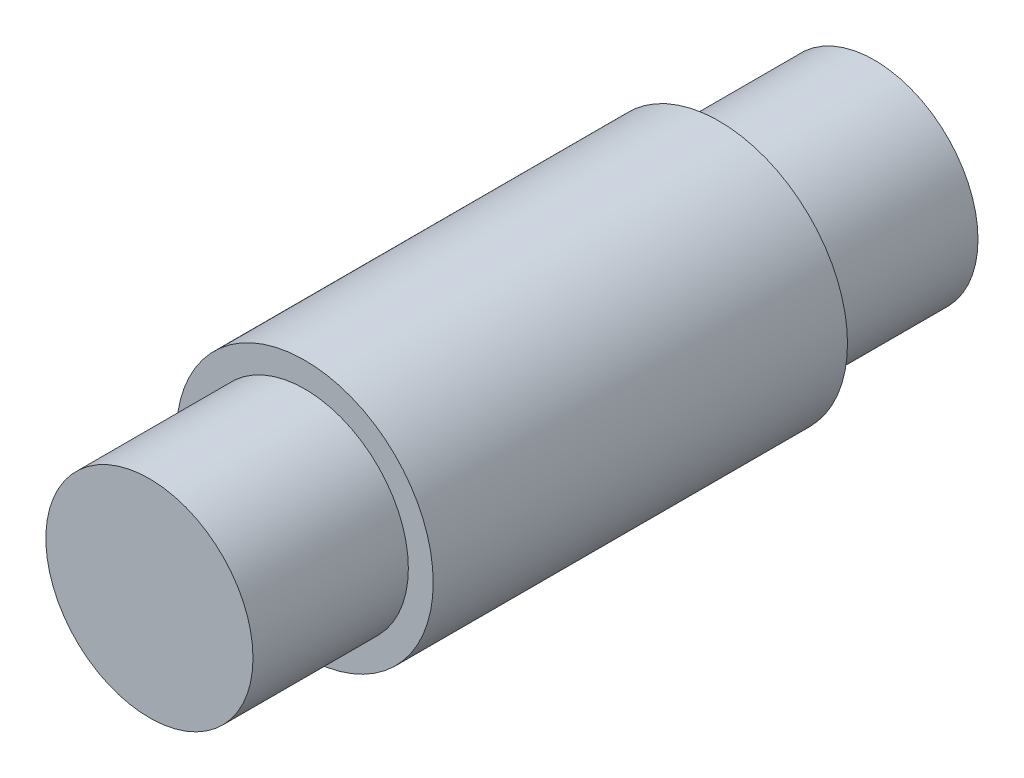
from build123d import *


with BuildPart() as part:
    # Sketch1 → Revolve1 (revolve)
    with BuildSketch(Plane(origin=(0, 0, 0), x_dir=(1, 0, 0), z_dir=(0, 1, 0))):
        Polygon((0, 0), (0, -4.7625), (0.762, -4.7625), (0.762, -17.4625), (0, -17.4625), (0, -22.225), (-3.175, -22.225), (-3.175, 0), align=None)
    revolve(axis=Axis((-3.175, 0, 22.225), (0, 0, -1)))


solid = part.part
